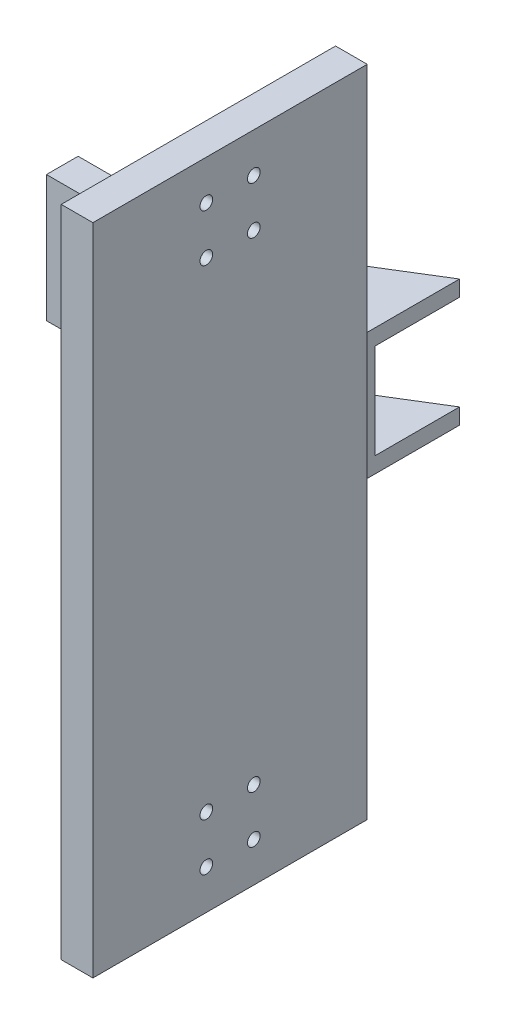
from build123d import *

# Parameters (mm, degrees)
SKETCH1_W           = 52
SKETCH1_H           = 124
BOSS_EXTRUDE1_DEPTH = 6
SKETCH2_W           = 56.3
SKETCH2_H           = 24
BOSS_EXTRUDE2_DEPTH = 6
BOSS_EXTRUDE3_DEPTH = 3
BOSS_EXTRUDE4_DEPTH = 3
SKETCH5_W           = 1.2
SKETCH5_H           = 6
SKETCH7_W           = 1.2
SKETCH7_H           = 6
SKETCH9_W           = 1.2
SKETCH9_H           = 6
SKETCH11_W          = 1.2
SKETCH11_H          = 6
SKETCH13_W          = 1.2
SKETCH13_H          = 6
SKETCH15_W          = 1.2
SKETCH15_H          = 6
SKETCH17_W          = 1.2
SKETCH17_H          = 6
SKETCH19_W          = 1.2
SKETCH19_H          = 6
SKETCH21_W          = 1.2
SKETCH21_H          = 59.5
SKETCH23_W          = 1.2
SKETCH23_H          = 59.5
SKETCH25_W          = 1.2
SKETCH25_H          = 59.5
SKETCH27_W          = 1.2
SKETCH27_H          = 59.5


with BuildPart() as part:
    # Sketch1 → Boss-Extrude1 (new body)
    with BuildSketch(Plane(origin=(-83.5, 0, 0), x_dir=(0, 0, -1), z_dir=(1, 0, 0))):
        Rectangle(SKETCH1_W, SKETCH1_H)
    extrude(amount=BOSS_EXTRUDE1_DEPTH)

    # Sketch5 → M2 Clearance Hole1 (revolve, cut)
    with BuildSketch(Plane(origin=(-83.5, 45.5, -4.5), x_dir=(0, 0, 1), z_dir=(0, 1, 0))):
        with Locations((0.6, 3)):
            Rectangle(SKETCH5_W, SKETCH5_H)
    revolve(axis=Axis((-89.85, 45.5, -4.5), (1, 0, 0)), mode=Mode.SUBTRACT)

    # Sketch7 → M2 Clearance Hole2 (revolve, cut)
    with BuildSketch(Plane(origin=(-83.5, 45.5, 4.5), x_dir=(0, 0, 1), z_dir=(0, 1, 0))):
        with Locations((0.6, 3)):
            Rectangle(SKETCH7_W, SKETCH7_H)
    revolve(axis=Axis((-89.85, 45.5, 4.5), (1, 0, 0)), mode=Mode.SUBTRACT)

    # Sketch9 → M2 Clearance Hole3 (revolve, cut)
    with BuildSketch(Plane(origin=(-83.5, 54.5, -4.5), x_dir=(0, 0, 1), z_dir=(0, 1, 0))):
        with Locations((0.6, 3)):
            Rectangle(SKETCH9_W, SKETCH9_H)
    revolve(axis=Axis((-89.85, 54.5, -4.5), (1, 0, 0)), mode=Mode.SUBTRACT)

    # Sketch11 → M2 Clearance Hole4 (revolve, cut)
    with BuildSketch(Plane(origin=(-83.5, 54.5, 4.5), x_dir=(0, 0, 1), z_dir=(0, 1, 0))):
        with Locations((0.6, 3)):
            Rectangle(SKETCH11_W, SKETCH11_H)
    revolve(axis=Axis((-89.85, 54.5, 4.5), (1, 0, 0)), mode=Mode.SUBTRACT)

    # Sketch13 → M2 Clearance Hole5 (revolve, cut)
    with BuildSketch(Plane(origin=(-83.5, -54.5, -4.5), x_dir=(0, 0, 1), z_dir=(0, 1, 0))):
        with Locations((0.6, 3)):
            Rectangle(SKETCH13_W, SKETCH13_H)
    revolve(axis=Axis((-89.85, -54.5, -4.5), (1, 0, 0)), mode=Mode.SUBTRACT)

    # Sketch15 → M2 Clearance Hole6 (revolve, cut)
    with BuildSketch(Plane(origin=(-83.5, -54.5, 4.5), x_dir=(0, 0, 1), z_dir=(0, 1, 0))):
        with Locations((0.6, 3)):
            Rectangle(SKETCH15_W, SKETCH15_H)
    revolve(axis=Axis((-89.85, -54.5, 4.5), (1, 0, 0)), mode=Mode.SUBTRACT)

    # Sketch17 → M2 Clearance Hole7 (revolve, cut)
    with BuildSketch(Plane(origin=(-83.5, -45.5, -4.5), x_dir=(0, 0, 1), z_dir=(0, 1, 0))):
        with Locations((0.6, 3)):
            Rectangle(SKETCH17_W, SKETCH17_H)
    revolve(axis=Axis((-89.85, -45.5, -4.5), (1, 0, 0)), mode=Mode.SUBTRACT)

    # Sketch19 → M2 Clearance Hole8 (revolve, cut)
    with BuildSketch(Plane(origin=(-83.5, -45.5, 4.5), x_dir=(0, 0, 1), z_dir=(0, 1, 0))):
        with Locations((0.6, 3)):
            Rectangle(SKETCH19_W, SKETCH19_H)
    revolve(axis=Axis((-89.85, -45.5, 4.5), (1, 0, 0)), mode=Mode.SUBTRACT)


with BuildPart() as body_2:
    # Sketch2 → Boss-Extrude2 (new body)
    with BuildSketch(Plane.XY.offset(-33.5)):
        with Locations((-111.65, 0)):
            Rectangle(SKETCH2_W, SKETCH2_H)
    extrude(amount=BOSS_EXTRUDE2_DEPTH)

    # Sketch3 → Boss-Extrude3 (add)
    with BuildSketch(Plane(origin=(0, 9, 0), x_dir=(1, 0, 0), z_dir=(0, 1, 0))):
        Polygon((-83.5, 33.5), (-83.5, 49.5), (-109.5, 33.5), align=None)
    extrude(amount=BOSS_EXTRUDE3_DEPTH)

    # Sketch4 → Boss-Extrude4 (add)
    with BuildSketch(Plane(origin=(0, -12, 0), x_dir=(1, 0, 0), z_dir=(0, 1, 0))):
        Polygon((-83.5, 33.5), (-83.5, 49.5), (-109.5, 33.5), align=None)
    extrude(amount=BOSS_EXTRUDE4_DEPTH)

    # Sketch21 → M2 Clearance Hole9 (revolve, cut)
    with BuildSketch(Plane(origin=(-109.3, 4.5, -33.5), x_dir=(0, 1, 0), z_dir=(1, 0, 0))):
        with Locations((0.6, 29.75)):
            Rectangle(SKETCH21_W, SKETCH21_H)
    revolve(axis=Axis((-109.3, 4.5, -39.85), (0, 0, 1)), mode=Mode.SUBTRACT)

    # Sketch23 → M2 Clearance Hole10 (revolve, cut)
    with BuildSketch(Plane(origin=(-109.3, -4.5, -33.5), x_dir=(0, 1, 0), z_dir=(1, 0, 0))):
        with Locations((0.6, 29.75)):
            Rectangle(SKETCH23_W, SKETCH23_H)
    revolve(axis=Axis((-109.3, -4.5, -39.85), (0, 0, 1)), mode=Mode.SUBTRACT)

    # Sketch25 → M2 Clearance Hole11 (revolve, cut)
    with BuildSketch(Plane(origin=(-118.3, 4.5, -33.5), x_dir=(0, 1, 0), z_dir=(1, 0, 0))):
        with Locations((0.6, 29.75)):
            Rectangle(SKETCH25_W, SKETCH25_H)
    revolve(axis=Axis((-118.3, 4.5, -39.85), (0, 0, 1)), mode=Mode.SUBTRACT)

    # Sketch27 → M2 Clearance Hole12 (revolve, cut)
    with BuildSketch(Plane(origin=(-118.3, -4.5, -33.5), x_dir=(0, 1, 0), z_dir=(1, 0, 0))):
        with Locations((0.6, 29.75)):
            Rectangle(SKETCH27_W, SKETCH27_H)
    revolve(axis=Axis((-118.3, -4.5, -39.85), (0, 0, 1)), mode=Mode.SUBTRACT)


solid = Compound([part.part, body_2.part])
